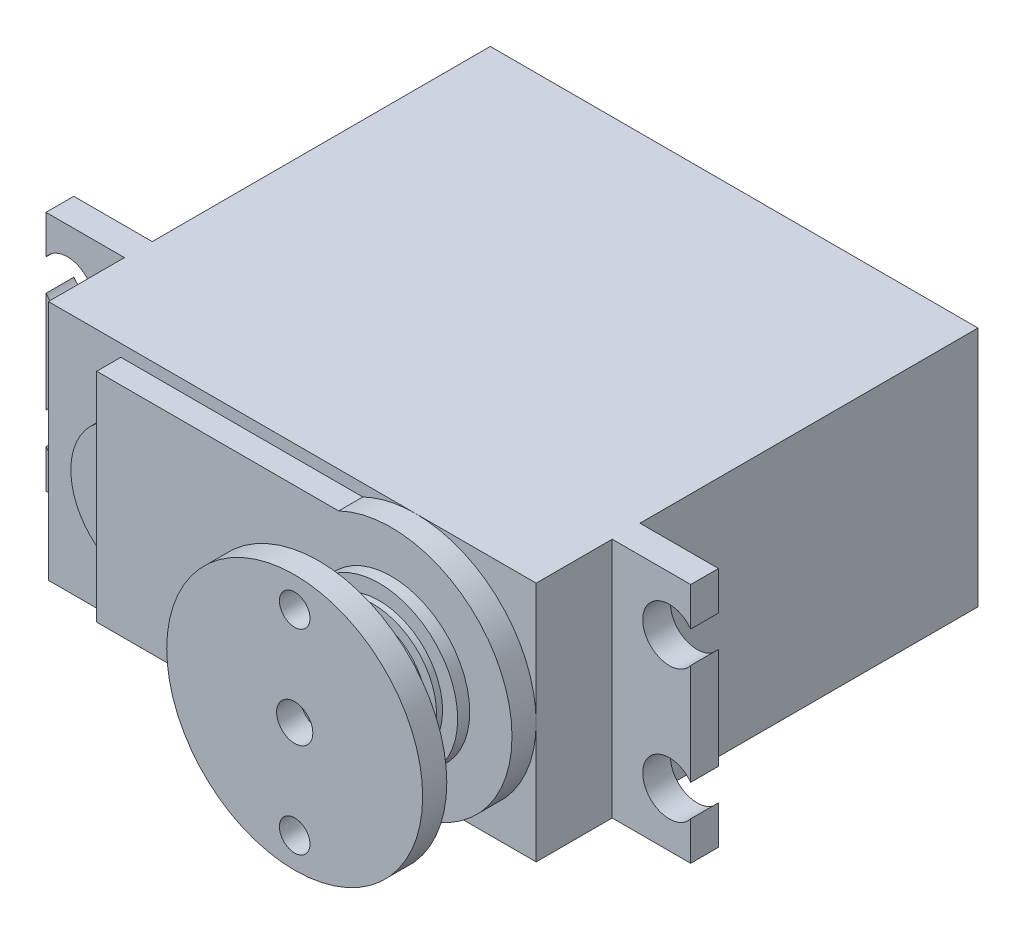
from build123d import *

# Parameters (mm, degrees)
SKETCH1_W           = 40.4
SKETCH1_H           = 20
BOSS_EXTRUDE1_DEPTH = 36.6
SKETCH2_W           = 2.3
SKETCH2_H           = 20
BOSS_EXTRUDE2_DEPTH = 6.5
SKETCH3_R           = 2.2
CUT_EXTRUDE1_DEPTH  = 6.5
BOSS_EXTRUDE4_DEPTH = 2
BOSS_EXTRUDE5_DEPTH = 1.5
SKETCH7_R           = 6.5
BOSS_EXTRUDE6_DEPTH = 1
SKETCH9_R           = 5.25
BOSS_EXTRUDE7_DEPTH = 0.5
SKETCH10_R          = 4.4
BOSS_EXTRUDE8_DEPTH = 4.5
SKETCH11_R          = 10.6
BOSS_EXTRUDE9_DEPTH = 2
SKETCH12_R          = 1.5
SKETCH12_R_2        = 1.264823641
CUT_EXTRUDE2_DEPTH  = 2
CIRPATTERN1_COUNT   = 2


with BuildPart() as part:
    # Sketch1 → Boss-Extrude1 (new body)
    with BuildSketch(Plane.XY):
        Rectangle(SKETCH1_W, SKETCH1_H)
    extrude(amount=BOSS_EXTRUDE1_DEPTH)

    # Sketch2 → Boss-Extrude2 (add)
    with BuildSketch(Plane(origin=(20.2, 0, 0), x_dir=(0, 0, -1), z_dir=(1, 0, 0))):
        with Locations((-29.15, 0)):
            Rectangle(SKETCH2_W, SKETCH2_H)
    boss_extrude2 = extrude(amount=BOSS_EXTRUDE2_DEPTH)

    # Sketch3 → Cut-Extrude1 (cut)
    with BuildSketch(Plane.XY.offset(30.3)):
        with Locations((24.929249083, -5.5)):
            Circle(SKETCH3_R)
        with Locations((24.929249083, 5.5)):
            Circle(SKETCH3_R)
    cut_extrude1 = extrude(amount=-CUT_EXTRUDE1_DEPTH, mode=Mode.SUBTRACT)

    # Mirror1: Boss-Extrude2, Cut-Extrude1 across plane
    add(boss_extrude2.mirror(Plane(origin=(0, 0, 0), x_dir=(0, 0, 1), z_dir=(1, 0, 0))))
    add(cut_extrude1.mirror(Plane(origin=(0, 0, 0), x_dir=(0, 0, 1), z_dir=(1, 0, 0))), mode=Mode.SUBTRACT)

    # Sketch5 → Boss-Extrude4 (add)
    with BuildSketch(Plane.XY.offset(36.6)):
        with BuildLine():
            Line((5.841101056, 9), (-14.2, 9))
            Line((-14.2, 9), (-14.2, 5.100716034))
            Line((-14.2, 5.100716034), (-14.2, -4.399283966))
            Line((-14.2, -4.399283966), (-14.2, -9))
            Line((-14.2, -9), (5.841101056, -9))
            ThreePointArc((5.841101056, -9), (0.2, 0), (5.841101056, 9))
        make_face()
        with BuildLine():
            ThreePointArc((20.2, 0), (15.510885546, 8.473163206), (5.841101056, 9))
            Line((5.841101056, 9), (5.841101056, -9))
            ThreePointArc((5.841101056, -9), (15.510885546, -8.473163206), (20.2, 0))
        make_face()
        with BuildLine():
            Line((5.841101056, -9), (5.841101056, 9))
            ThreePointArc((5.841101056, 9), (0.2, 0), (5.841101056, -9))
        make_face()
        with BuildLine():
            ThreePointArc((20.2, 0), (15.510885546, 8.473163206), (5.841101056, 9))
            Line((5.841101056, 9), (5.841101056, -9))
            ThreePointArc((5.841101056, -9), (15.510885546, -8.473163206), (20.2, 0))
        make_face()
        with BuildLine():
            Line((5.841101056, -9), (5.841101056, 9))
            ThreePointArc((5.841101056, 9), (0.2, 0), (5.841101056, -9))
        make_face()
    extrude(amount=BOSS_EXTRUDE4_DEPTH)

    # Sketch6 → Boss-Extrude5 (add)
    with BuildSketch(Plane.XY.offset(36.6)):
        with BuildLine():
            Line((-14.2, -4.399283966), (-14.2, 5.100716034))
            ThreePointArc((-14.2, 5.100716034), (-16.842653315, 0.350716034), (-14.2, -4.399283966))
        make_face()
    extrude(amount=BOSS_EXTRUDE5_DEPTH)

    # Sketch7 → Boss-Extrude6 (add)
    with BuildSketch(Plane.XY.offset(38.6)):
        with Locations((10.2, 0)):
            Circle(SKETCH7_R)
    extrude(amount=BOSS_EXTRUDE6_DEPTH)

    # Sketch9 → Boss-Extrude7 (add)
    with BuildSketch(Plane.XY.offset(39.6)):
        with Locations((10.2, 0)):
            Circle(SKETCH9_R)
    extrude(amount=BOSS_EXTRUDE7_DEPTH)

    # Sketch10 → Boss-Extrude8 (add)
    with BuildSketch(Plane.XY.offset(40.1)):
        with Locations((10.2, 0)):
            Circle(SKETCH10_R)
    extrude(amount=BOSS_EXTRUDE8_DEPTH)

    # Sketch11 → Boss-Extrude9 (add)
    with BuildSketch(Plane.XY.offset(44.6)):
        with Locations((10.2, 0)):
            Circle(SKETCH11_R)
    extrude(amount=BOSS_EXTRUDE9_DEPTH)

    # Sketch12 → Cut-Extrude2 (cut)
    with BuildSketch(Plane.XY.offset(46.6)):
        with Locations((10.2, 0)):
            Circle(SKETCH12_R)
        with Locations((10.2, -8.1)):
            Circle(SKETCH12_R_2)
    cut_extrude2 = extrude(amount=-CUT_EXTRUDE2_DEPTH, mode=Mode.SUBTRACT)

    # CirPattern1: Cut-Extrude2 ×2 about axis
    cirpattern1_axis = Axis((10.2, 0, 0), (0, 0, 1))
    for i in range(1, CIRPATTERN1_COUNT):
        add(cut_extrude2.rotate(cirpattern1_axis, i * 360 / CIRPATTERN1_COUNT), mode=Mode.SUBTRACT)


solid = part.part
